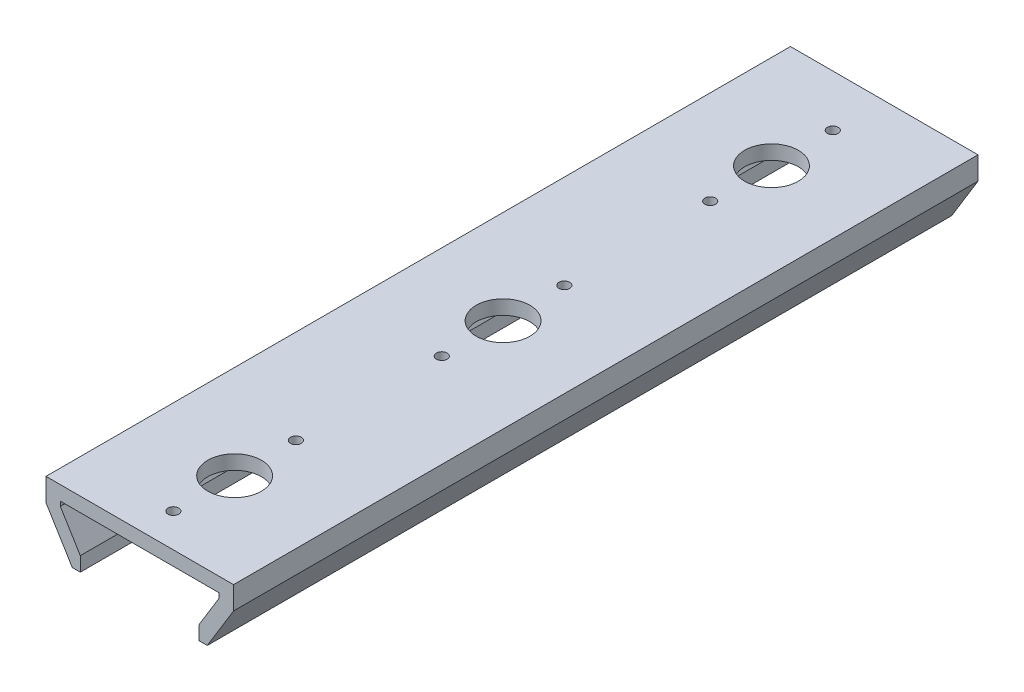
from build123d import *

# Parameters (mm, degrees)
BOSS_EXTRUDE1_DEPTH        = 213
SKETCH2_R                  = 7.5
CUT_EXTRUDE1_DEPTH         = 213
SKETCH7_R                  = 1.5
CUT_EXTRUDE2_DEPTH         = 10
LPATTERN1_COUNT            = 3
LPATTERN1_PITCH            = 75
SZKIC1_W                   = 52.4
SZKIC1_H                   = 5
WYTNIJ_WYCI_GNI_CIE1_DEPTH = 30.5


with BuildPart() as part:
    # Sketch1 → Boss-Extrude1 (new body)
    with BuildSketch(Plane.XY):
        Polygon((0, -13.289354466), (-22.2, -13.289354466), (-22.2, -14.545627613), (-16.612166923, -23.689354466), (-16.612166923, -27.689354466), (-18.855505392, -27.689354466), (-26.2, -15.671090562), (-26.2, -9.289354466), (26.2, -9.289354466), (26.2, -15.671090562), (18.855505392, -27.689354466), (16.612166923, -27.689354466), (16.612166923, -23.689354466), (22.2, -14.545627613), (22.2, -13.289354466), align=None)
    extrude(amount=BOSS_EXTRUDE1_DEPTH)

    # Sketch2 → Cut-Extrude1 (cut)
    with BuildSketch(Plane(origin=(0, -9.289354466, 0), x_dir=(1, 0, 0), z_dir=(0, 1, 0))):
        with Locations(Location((0, -31.5, 0), (0, 0, 180))):
            Circle(SKETCH2_R)
        with Locations(Location((0, -106.5, 0), (0, 0, 180))):
            Circle(SKETCH2_R)
        with Locations(Location((0, -181.5, 0), (0, 0, 180))):
            Circle(SKETCH2_R)
    extrude(amount=-CUT_EXTRUDE1_DEPTH, mode=Mode.SUBTRACT)

    # Sketch7 → Cut-Extrude2 (cut)
    with BuildSketch(Plane(origin=(0, -9.289354466, 0), x_dir=(1, 0, 0), z_dir=(0, 1, 0))):
        with Locations(Location((0, -198.624297731, 0), (0, 0, 180))):
            Circle(SKETCH7_R)
        with Locations(Location((0, -164.375702269, 0), (0, 0, 180))):
            Circle(SKETCH7_R)
    cut_extrude2 = extrude(amount=-CUT_EXTRUDE2_DEPTH, mode=Mode.SUBTRACT)

    # LPattern1: Cut-Extrude2 ×3
    with Locations(*[(0, 0, -i * LPATTERN1_PITCH) for i in range(1, LPATTERN1_COUNT)]):
        add(cut_extrude2, mode=Mode.SUBTRACT)

    # Szkic1 → Wytnij-wyciągnięcie1 (cut)
    with BuildSketch(Plane(origin=(0, -9.289354466, 0), x_dir=(1, 0, 0), z_dir=(0, 1, 0))):
        with Locations((0, -210.5)):
            Rectangle(SZKIC1_W, SZKIC1_H)
    extrude(amount=-WYTNIJ_WYCI_GNI_CIE1_DEPTH, mode=Mode.SUBTRACT)


solid = part.part
